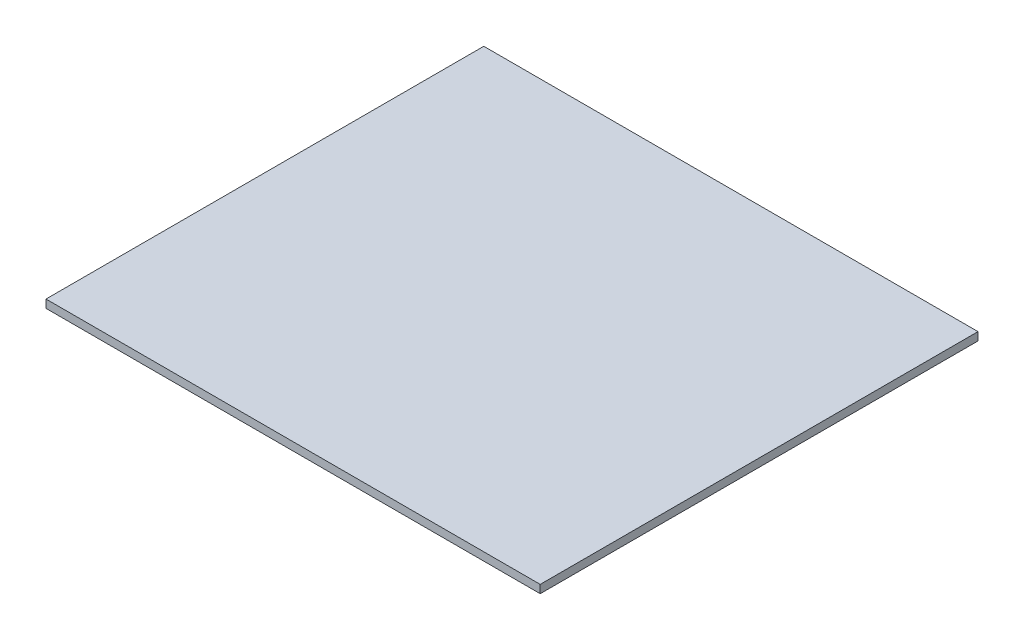
from build123d import *

# Parameters (mm, degrees)
SKETCH1_W           = 304.8
SKETCH1_H           = 270
BOSS_EXTRUDE1_DEPTH = 5


with BuildPart() as part:
    # Sketch1 → Boss-Extrude1 (new body)
    with BuildSketch(Plane(origin=(0, 0, 0), x_dir=(1, 0, 0), z_dir=(0, 1, 0))):
        Rectangle(SKETCH1_W, SKETCH1_H)
    extrude(amount=BOSS_EXTRUDE1_DEPTH)


solid = part.part
